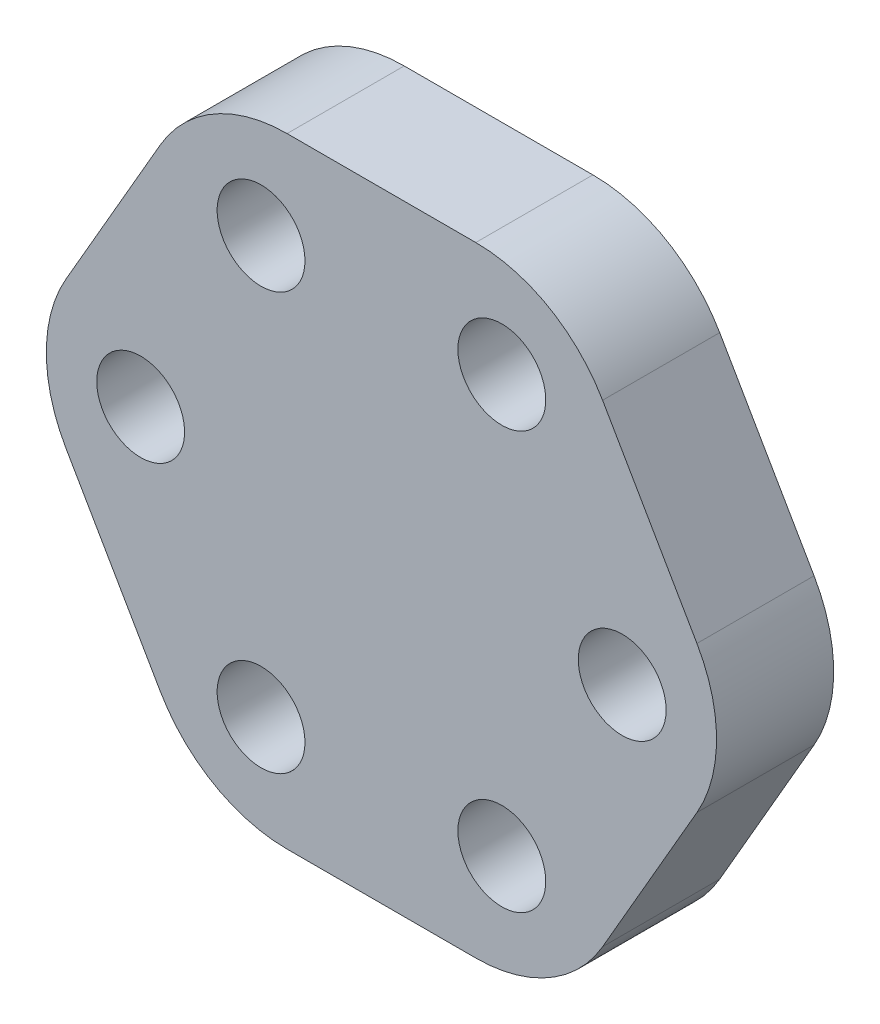
from build123d import *

# Parameters (mm, degrees)
BOSS_EXTRUDE1_DEPTH = 4
FILLET1_R           = 5
SKETCH2_R           = 1.5
CUT_EXTRUDE1_DEPTH  = 17.091809531
CIRPATTERN1_COUNT   = 6


with BuildPart() as part:
    # Sketch1 → Boss-Extrude1 (new body)
    with BuildSketch(Plane.XY):
        Polygon((6.109123402, -10.581312122), (12.218246804, 0), (6.109123402, 10.581312122), (-6.109123402, 10.581312122), (-12.218246804, 0), (-6.109123402, -10.581312122), align=None)
    extrude(amount=BOSS_EXTRUDE1_DEPTH)

    # Fillet1
    fillet1_edges = [part.edges().sort_by_distance(p)[0] for p in [
        (6.109123402, -10.581312122, 2),
        (-6.109123402, -10.581312122, 2),
        (-12.218246804, 0, 2),
        (12.218246804, 0, 2),
        (6.109123402, 10.581312122, 2),
        (-6.109123402, 10.581312122, 2),
    ]]
    fillet(fillet1_edges, radius=FILLET1_R)

    # Sketch2 → Cut-Extrude1 (cut, through all)
    with BuildSketch(Plane.XY.offset(4)):
        with Locations((-4.111186028, -7.12078308)):
            Circle(SKETCH2_R)
    cut_extrude1 = extrude(amount=-CUT_EXTRUDE1_DEPTH, mode=Mode.SUBTRACT)

    # CirPattern1: Cut-Extrude1 ×6 about axis
    cirpattern1_axis = Axis((0, 0, -80.9), (0, 0, 1))
    for i in range(1, CIRPATTERN1_COUNT):
        add(cut_extrude1.rotate(cirpattern1_axis, i * 360 / CIRPATTERN1_COUNT), mode=Mode.SUBTRACT)


solid = part.part
